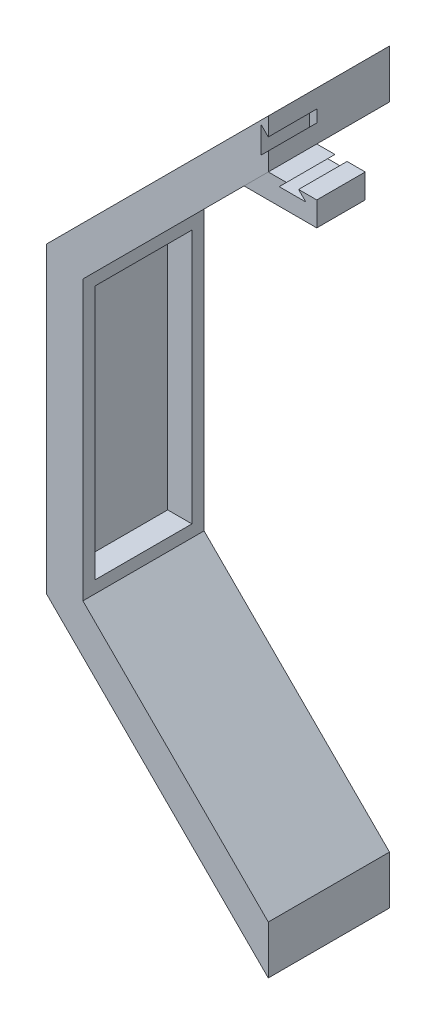
from build123d import *

# Parameters (mm, degrees)
BOSS_EXTRU_1_DEPTH      = 50
BOSS_EXTRU_2_DEPTH      = 20
ENL_V_MAT_EXTRU_1_DEPTH = 10
ESQUISSE4_W             = 40
ESQUISSE4_H             = 105
ENL_V_MAT_EXTRU_2_DEPTH = 10
ENL_V_MAT_EXTRU_3_DEPTH = 20


with BuildPart() as part:
    # Esquisse1 → Boss.-Extru.1 (new body)
    with BuildSketch(Plane.XY):
        Polygon((0, -62.5), (0, 62.5), (91.5, 154), (91.5, 134), (15, 57.5), (15, -57.5), (91.5, -134), (91.5, -154), align=None)
    extrude(amount=BOSS_EXTRU_1_DEPTH)

    # Esquisse3 → Enlèv. mat.-Extru.1 (cut)
    with BuildSketch(Plane(origin=(-21.25, 21.25, 0), x_dir=(0, 0, -1), z_dir=(0.7071067811865468, -0.7071067811865482, 0))):
        Polygon((-5, 51.265241636), (-45, 51.265241636), (-45, 145.310443534), (-30, 145.310443534), (-30, 154.452579158), (-5, 154.452579158), align=None)
    extrude(amount=-ENL_V_MAT_EXTRU_1_DEPTH, mode=Mode.SUBTRACT)

    # Esquisse4 → Enlèv. mat.-Extru.2 (cut)
    with BuildSketch(Plane(origin=(15, 0, 0), x_dir=(0, 0, -1), z_dir=(1, 0, 0))):
        with Locations((-25, 0)):
            Rectangle(ESQUISSE4_W, ESQUISSE4_H)
    extrude(amount=-ENL_V_MAT_EXTRU_2_DEPTH, mode=Mode.SUBTRACT)

    # Esquisse5 → Enlèv. mat.-Extru.3 (cut)
    with BuildSketch(Plane.XY.offset(50)):
        Polygon((91.5, 146.5), (88.5, 149.5), (88.5, 138.5), (91.5, 141.5), align=None)
    extrude(amount=-ENL_V_MAT_EXTRU_3_DEPTH, mode=Mode.SUBTRACT)


with BuildPart() as body_2:
    # Esquisse2 → Boss.-Extru.2 (new body)
    with BuildSketch(Plane.XY.offset(50)):
        Polygon((91.5, 134), (99, 134), (96, 131), (107, 131), (104, 134), (111.5, 134), (111.5, 124), (81.5, 124), align=None)
    extrude(amount=-BOSS_EXTRU_2_DEPTH)


solid = Compound([part.part, body_2.part])
